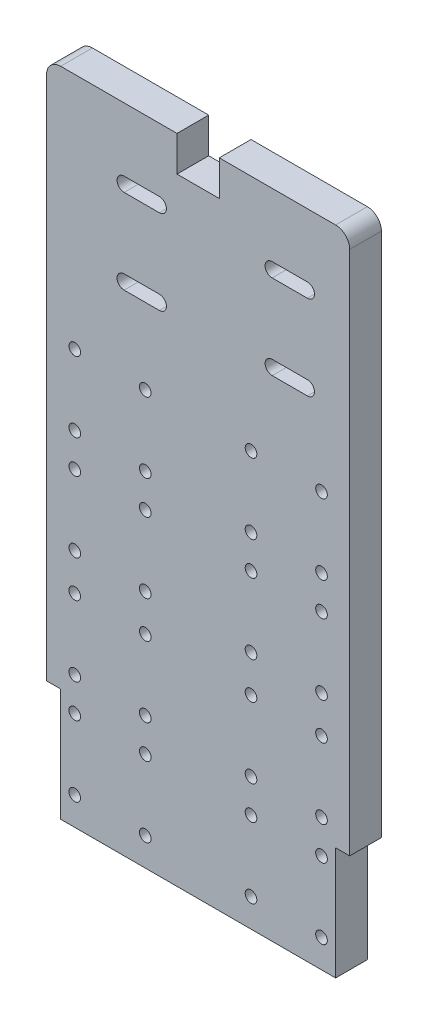
from build123d import *

# Parameters (mm, degrees)
ESQUISSE1_W             = 86
ESQUISSE1_H             = 185
BOSS_EXTRU_1_DEPTH      = 9
ESQUISSE2_R             = 1.65
ENL_V_MAT_EXTRU_1_DEPTH = 205.210675529
ESQUISSE3_R             = 1.65
ENL_V_MAT_EXTRU_2_DEPTH = 205.210675529
ESQUISSE4_W             = 4
ESQUISSE4_H             = 32
ENL_V_MAT_EXTRU_3_DEPTH = 205.210675529
ENL_V_MAT_EXTRU_4_DEPTH = 205.210675529
ESQUISSE7_W             = 12
ESQUISSE7_H             = 10
ENL_V_MAT_EXTRU_5_DEPTH = 205.210675529
CONG_1_R                = 4


with BuildPart() as part:
    # Esquisse1 → Boss.-Extru.1 (new body)
    with BuildSketch(Plane.XY):
        with Locations((43, 92.5)):
            Rectangle(ESQUISSE1_W, ESQUISSE1_H)
    extrude(amount=BOSS_EXTRU_1_DEPTH)

    # Esquisse2 → Enlèv. mat.-Extru.1 (cut, through all)
    with BuildSketch(Plane.XY.offset(9)):
        with Locations((8, 57.5)):
            Circle(ESQUISSE2_R)
        with Locations(Location((28, 57.5, 0), (0, 0, 180))):
            Circle(ESQUISSE2_R)
        with Locations((28, 37.5)):
            Circle(ESQUISSE2_R)
        with Locations(Location((8, 37.5, 0), (0, 0, 180))):
            Circle(ESQUISSE2_R)
        with Locations((78, 37.5)):
            Circle(ESQUISSE2_R)
        with Locations(Location((58, 37.5, 0), (0, 0, 180))):
            Circle(ESQUISSE2_R)
        with Locations((58, 57.5)):
            Circle(ESQUISSE2_R)
        with Locations(Location((78, 57.5, 0), (0, 0, 180))):
            Circle(ESQUISSE2_R)
        with Locations((78, 97.5)):
            Circle(ESQUISSE2_R)
        with Locations(Location((58, 97.5, 0), (0, 0, 180))):
            Circle(ESQUISSE2_R)
        with Locations((58, 117.5)):
            Circle(ESQUISSE2_R)
        with Locations(Location((78, 117.5, 0), (0, 0, 180))):
            Circle(ESQUISSE2_R)
        with Locations((8, 117.5)):
            Circle(ESQUISSE2_R)
        with Locations(Location((28, 117.5, 0), (0, 0, 180))):
            Circle(ESQUISSE2_R)
        with Locations((28, 97.5)):
            Circle(ESQUISSE2_R)
        with Locations(Location((8, 97.5, 0), (0, 0, 180))):
            Circle(ESQUISSE2_R)
    extrude(amount=-ENL_V_MAT_EXTRU_1_DEPTH, mode=Mode.SUBTRACT)

    # Esquisse3 → Enlèv. mat.-Extru.2 (cut, through all)
    with BuildSketch(Plane.XY.offset(9)):
        with Locations((8, 28)):
            Circle(ESQUISSE3_R)
        with Locations(Location((8, 8, 0), (0, 0, 180))):
            Circle(ESQUISSE3_R)
        with Locations((28, 8)):
            Circle(ESQUISSE3_R)
        with Locations(Location((28, 28, 0), (0, 0, 180))):
            Circle(ESQUISSE3_R)
        with Locations((28, 68)):
            Circle(ESQUISSE3_R)
        with Locations(Location((28, 88, 0), (0, 0, 180))):
            Circle(ESQUISSE3_R)
        with Locations((8, 88)):
            Circle(ESQUISSE3_R)
        with Locations(Location((8, 68, 0), (0, 0, 180))):
            Circle(ESQUISSE3_R)
        with Locations((78, 68)):
            Circle(ESQUISSE3_R)
        with Locations(Location((78, 88, 0), (0, 0, 180))):
            Circle(ESQUISSE3_R)
        with Locations((58, 88)):
            Circle(ESQUISSE3_R)
        with Locations(Location((58, 68, 0), (0, 0, 180))):
            Circle(ESQUISSE3_R)
        with Locations((58, 28)):
            Circle(ESQUISSE3_R)
        with Locations(Location((58, 8, 0), (0, 0, 180))):
            Circle(ESQUISSE3_R)
        with Locations((78, 8)):
            Circle(ESQUISSE3_R)
        with Locations(Location((78, 28, 0), (0, 0, 180))):
            Circle(ESQUISSE3_R)
    extrude(amount=-ENL_V_MAT_EXTRU_2_DEPTH, mode=Mode.SUBTRACT)

    # Esquisse4 → Enlèv. mat.-Extru.3 (cut, through all)
    with BuildSketch(Plane.XY.offset(9)):
        with Locations((2, 16)):
            Rectangle(ESQUISSE4_W, ESQUISSE4_H)
        with Locations((84, 16)):
            Rectangle(ESQUISSE4_W, ESQUISSE4_H)
    extrude(amount=-ENL_V_MAT_EXTRU_3_DEPTH, mode=Mode.SUBTRACT)

    # Esquisse6 → Enlèv. mat.-Extru.4 (cut, through all)
    with BuildSketch(Plane.XY.offset(9)):
        with BuildLine():
            Line((22, 167), (32, 167))
            ThreePointArc((32, 167), (34, 165), (32, 163))
            Line((32, 163), (22, 163))
            ThreePointArc((22, 163), (20, 165), (22, 167))
        make_face()
        with BuildLine():
            Line((22, 139), (32, 139))
            ThreePointArc((32, 139), (34, 141), (32, 143))
            Line((32, 143), (22, 143))
            ThreePointArc((22, 143), (20, 141), (22, 139))
        make_face()
        with BuildLine():
            Line((74, 167), (64, 167))
            ThreePointArc((64, 167), (62, 165), (64, 163))
            Line((64, 163), (74, 163))
            ThreePointArc((74, 163), (76, 165), (74, 167))
        make_face()
        with BuildLine():
            Line((74, 139), (64, 139))
            ThreePointArc((64, 139), (62, 141), (64, 143))
            Line((64, 143), (74, 143))
            ThreePointArc((74, 143), (76, 141), (74, 139))
        make_face()
    extrude(amount=-ENL_V_MAT_EXTRU_4_DEPTH, mode=Mode.SUBTRACT)

    # Esquisse7 → Enlèv. mat.-Extru.5 (cut, through all)
    with BuildSketch(Plane.XY.offset(9)):
        with Locations((43, 180)):
            Rectangle(ESQUISSE7_W, ESQUISSE7_H)
    extrude(amount=-ENL_V_MAT_EXTRU_5_DEPTH, mode=Mode.SUBTRACT)

    # Congé1
    cong_1_edges = [part.edges().sort_by_distance(p)[0] for p in [
        (0, 185, 4.5),
        (86, 185, 4.5),
    ]]
    fillet(cong_1_edges, radius=CONG_1_R)


solid = part.part
